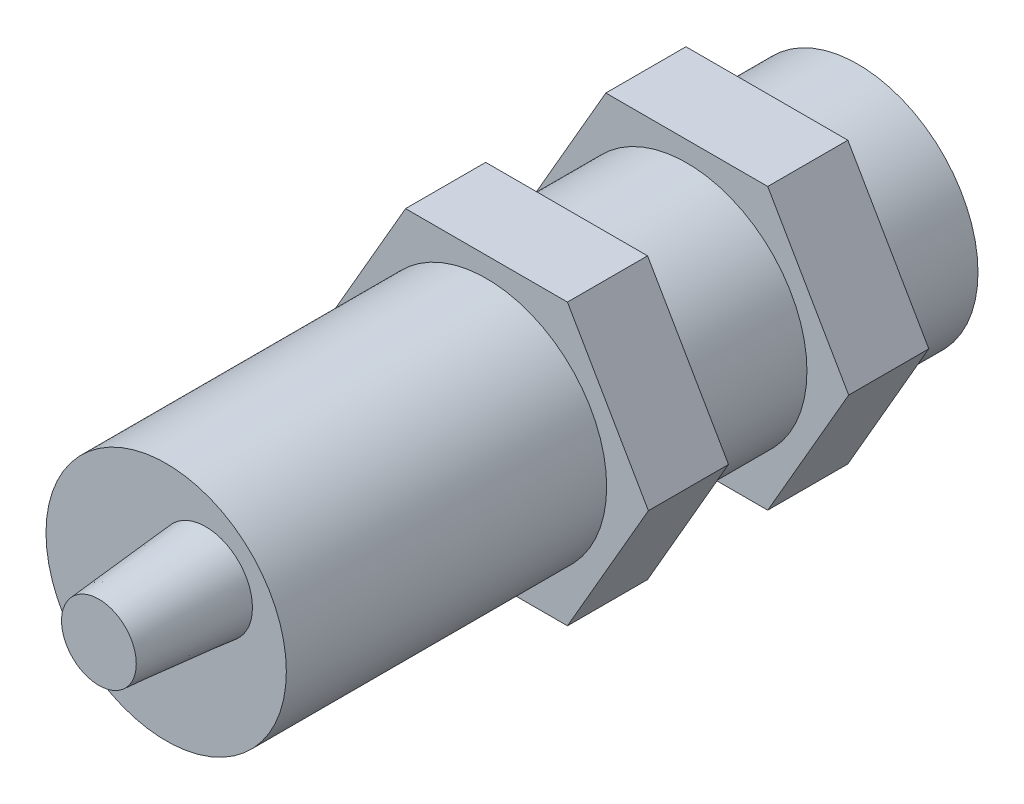
from build123d import *

# Parameters (mm, degrees)
IZIM1_R                     = 9
Y_KSEKLIK_EKSTR_ZYON1_DEPTH = 51.8
IZIM2_R                     = 3.5
Y_KSEKLIK_EKSTR_ZYON2_DEPTH = 8
Y_KSEKLIK_EKSTR_ZYON2_TAPER = 5
Y_KSEKLIK_EKSTR_ZYON3_DEPTH = 6
LPATTERN1_COUNT             = 2
LPATTERN1_PITCH             = 15


with BuildPart() as part:
    # Çizim1 → Yükseklik-Ekstrüzyon1 (new body)
    with BuildSketch(Plane.XY):
        with Locations(Location((0, 0, 0), (0, 0, 180))):
            Circle(IZIM1_R)
    extrude(amount=Y_KSEKLIK_EKSTR_ZYON1_DEPTH)

    # Çizim2 → Yükseklik-Ekstrüzyon2 (add)
    with BuildSketch(Plane.XY.offset(51.8)):
        with Locations((2.961323267, 2.878406216)):
            Circle(IZIM2_R)
    extrude(amount=Y_KSEKLIK_EKSTR_ZYON2_DEPTH, taper=Y_KSEKLIK_EKSTR_ZYON2_TAPER)

    # Çizim6 → Yükseklik-Ekstrüzyon3 (add)
    with BuildSketch(Plane(origin=(0, 0, 6.81), x_dir=(-1, 0, 0), z_dir=(0, 0, -1))):
        Polygon((6.062177826, 10.5), (-6.062177826, 10.5), (-12.124355653, 0), (-6.062177826, -10.5), (6.062177826, -10.5), (12.124355653, 0), align=None)
    y_kseklik_ekstr_zyon3 = extrude(amount=-Y_KSEKLIK_EKSTR_ZYON3_DEPTH)

    # LPattern1: Yükseklik-Ekstrüzyon3 ×2
    with Locations(*[(0, 0, i * LPATTERN1_PITCH) for i in range(1, LPATTERN1_COUNT)]):
        add(y_kseklik_ekstr_zyon3)


solid = part.part
